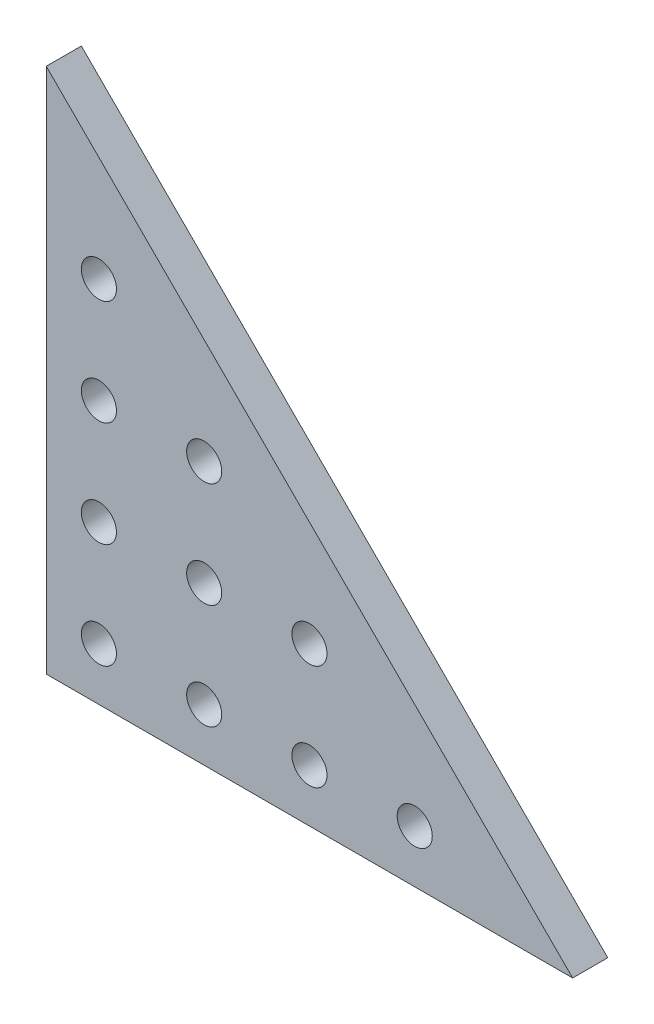
from build123d import *

# Parameters (mm, degrees)
MODEL_R                 = 1.5
SALIENTE_EXTRUIR1_DEPTH = 3


with BuildPart() as part:
    # Model → Saliente-Extruir1 (new body)
    with BuildSketch(Plane.XY):
        Polygon((-105.943383637, 105.556539338), (-105.943383637, 60.556539338), (-60.943383637, 60.556539338), align=None)
        with Locations((-101.443383637, 92.056539338)):
            Circle(MODEL_R, mode=Mode.SUBTRACT)
        with Locations((-101.443383637, 83.056539338)):
            Circle(MODEL_R, mode=Mode.SUBTRACT)
        with Locations((-92.443383637, 83.056539338)):
            Circle(MODEL_R, mode=Mode.SUBTRACT)
        with Locations((-101.443383637, 74.056539338)):
            Circle(MODEL_R, mode=Mode.SUBTRACT)
        with Locations((-92.443383637, 74.056539338)):
            Circle(MODEL_R, mode=Mode.SUBTRACT)
        with Locations((-83.443383637, 74.056539338)):
            Circle(MODEL_R, mode=Mode.SUBTRACT)
        with Locations((-101.443383637, 65.056539338)):
            Circle(MODEL_R, mode=Mode.SUBTRACT)
        with Locations((-92.443383637, 65.056539338)):
            Circle(MODEL_R, mode=Mode.SUBTRACT)
        with Locations((-83.443383637, 65.056539338)):
            Circle(MODEL_R, mode=Mode.SUBTRACT)
        with Locations((-74.443383637, 65.056539338)):
            Circle(MODEL_R, mode=Mode.SUBTRACT)
    extrude(amount=SALIENTE_EXTRUIR1_DEPTH)


solid = part.part
